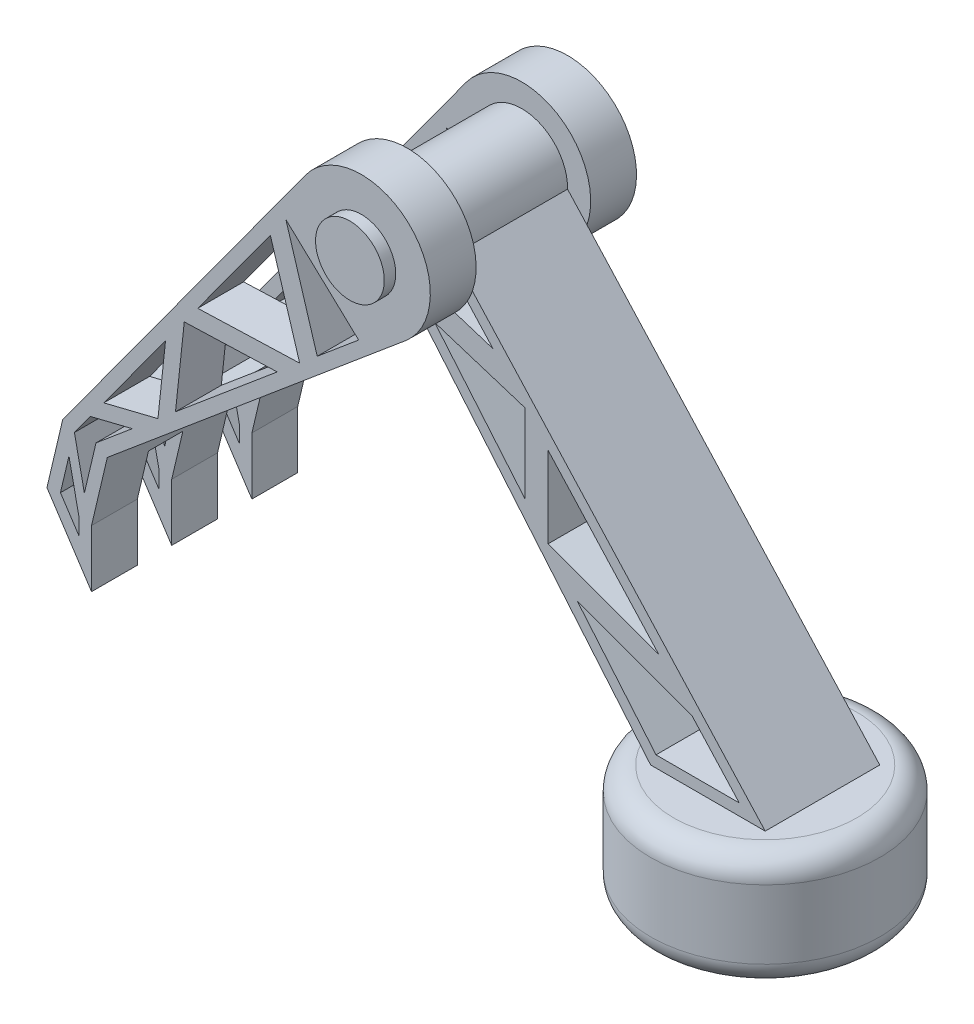
from build123d import *

# Parameters (mm, degrees)
SKETCH2_R            = 12.7
BOSS_EXTRUDE1_DEPTH  = 12.7
BOSS_EXTRUDE2_DEPTH  = 6.35
CUT_EXTRUDE1_START   = -6.35
CUT_EXTRUDE1_DEPTH   = 7.62
BOSS_EXTRUDE3_DEPTH  = 6.35
SKETCH6_R            = 3.81
BOSS_EXTRUDE4_DEPTH  = 12.7
BOSS_EXTRUDE5_START  = -1.27
SKETCH7_R            = 7.64274541
SKETCH7_R_2          = 3.81
BOSS_EXTRUDE5_DEPTH  = 5.08
CUT_EXTRUDE2_DEPTH   = 94.001963864
SKETCH14_R           = 7.62
CUT_EXTRUDE3_DEPTH   = 6.35
BOSS_EXTRUDE12_REACH = 93.815
FILLET1_R            = 2.54
CUT_EXTRUDE5_REACH   = 105.401
SKETCH16_W           = 3.81
SKETCH16_H           = 8.99772588


with BuildPart() as part:
    # Sketch2 → Boss-Extrude1 (new body)
    with BuildSketch(Plane(origin=(0, 0, 0), x_dir=(1, 0, 0), z_dir=(0, 1, 0))):
        with Locations(Location((0, 0, 0), (0, 0, 270))):
            Circle(SKETCH2_R)
    extrude(amount=BOSS_EXTRUDE1_DEPTH)

    # Sketch3 → Boss-Extrude2 (add, symmetric)
    with BuildSketch(Plane.XY):
        with BuildLine():
            Line((6.35, 12.7), (-28.263014494, 50.680235189))
            ThreePointArc((-28.263014494, 50.680235189), (-36.606963582, 54.691505771), (-34.105544768, 45.777770191))
            Line((-34.105544768, 45.777770191), (-6.35, 12.7))
            Line((-6.35, 12.7), (6.35, 12.7))
        make_face()
    extrude(amount=BOSS_EXTRUDE2_DEPTH, both=True)

    # Sketch4 → Cut-Extrude1 (cut, symmetric)
    with BuildSketch(Plane.XY.offset(6.35).offset(CUT_EXTRUDE1_START)):
        with BuildLine():
            Line((-5.757789274, 13.97), (3.474314319, 13.97))
            Line((3.474314319, 13.97), (-29.573983747, 50.233300134))
            ThreePointArc((-29.573983747, 50.233300134), (-35.779559637, 53.727877238), (-33.46657952, 46.992050322))
            Line((-33.46657952, 46.992050322), (-5.757789274, 13.97))
        make_face()
    extrude(amount=CUT_EXTRUDE1_DEPTH, both=True, mode=Mode.SUBTRACT)

    # Sketch5 → Boss-Extrude3 (add, symmetric)
    with BuildSketch(Plane.XY):
        Polygon((-23.82267484, 43.922492823), (-20.27066661, 40.024938393), (-30.298747694, 43.216775363), (-33.46657952, 46.992050322), align=None)
        Polygon((-20.27066661, 40.024938393), (-20.27066661, 31.265773704), (-17.73066661, 28.238719579), (-17.73066661, 37.237842303), align=None)
        Polygon((-5.458773455, 23.772115752), (-1.772739842, 19.727497693), (-14.465305553, 24.347213808), (-17.73066661, 28.238719579), align=None)
    extrude(amount=BOSS_EXTRUDE3_DEPTH, both=True)

    # Sketch6 → Boss-Extrude4 (add, symmetric)
    with BuildSketch(Plane.XY):
        with Locations((-33.341602525, 50.8)):
            Circle(SKETCH6_R)
    extrude(amount=BOSS_EXTRUDE4_DEPTH, both=True)

    # Sketch7 → Boss-Extrude5 (add)
    # profile 1 of 4: a face of its own
    with BuildSketch(Plane.XY.offset(12.7).offset(BOSS_EXTRUDE5_START)):
        with Locations((-33.341602525, 50.8)):
            Circle(SKETCH7_R)
        with Locations(Location((-33.341602525, 50.8, 0), (0, 0, 268.120225958))):
            Circle(SKETCH7_R_2, mode=Mode.SUBTRACT)
    # profile 2 of 4: a face of its own
    with BuildSketch(Plane.XY.offset(12.7).offset(BOSS_EXTRUDE5_START)):
        with BuildLine():
            ThreePointArc((-28.428940471, 44.945317348), (-38.558455358, 45.2146617), (-39.517448502, 55.302275411))
            Line((-39.517448502, 55.302275411), (-66.450706217, 18.357478363))
            Line((-66.450706217, 18.357478363), (-61.506739525, 17.189748362))
            Line((-61.506739525, 17.189748362), (-28.428940471, 44.945317348))
        make_face()
    # profile 3 of 4: a face of its own
    with BuildSketch(Plane.XY.offset(12.7).offset(BOSS_EXTRUDE5_START)):
        Polygon((-61.506739525, 17.189748362), (-63.258334527, 9.773798325), (-68.202301218, 10.941528326), (-66.450706217, 18.357478363), align=None)
    # profile 4 of 4: a face of its own
    with BuildSketch(Plane.XY.offset(12.7).offset(BOSS_EXTRUDE5_START)):
        Polygon((-68.202301218, 10.941528326), (-63.258334527, 3.423798325), (-63.258334527, 9.773798325), align=None)
    extrude(amount=-BOSS_EXTRUDE5_DEPTH)

    # Sketch10 → Cut-Extrude2 (cut, through all)
    with BuildSketch(Plane.XY.offset(11.43)):
        Polygon((-43.431264654, 47.562180038), (-51.48051274, 36.520892717), (-40.182838097, 36.906280169), align=None)
        Polygon((-52.976804835, 34.468403992), (-53.949591662, 25.35460233), (-42.669146252, 34.820019913), align=None)
        Polygon((-55.05214832, 31.621620856), (-61.893965932, 22.236585976), (-55.895344547, 23.721921802), align=None)
        Polygon((-64.655334527, 9.936540168), (-65.75979615, 15.205273966), (-66.70434579, 11.206214291), (-64.655334527, 8.090515014), align=None)
        Polygon((-63.390258027, 20.184097251), (-65.155875161, 17.762170896), (-64.051413538, 12.493437098), (-62.759783939, 17.96197324), (-58.739005045, 21.335807327), align=None)
        Polygon((-41.708282924, 49.925622701), (-38.237085212, 38.538960697), (-33.643800576, 42.393184141), align=None)
    extrude(amount=-CUT_EXTRUDE2_DEPTH, mode=Mode.SUBTRACT)

    # Mirror1: part across plane


with BuildPart() as part_1:
    add(part.part)
    add(part.part.mirror(Plane.XY))

    # Sketch14 → Cut-Extrude3 (cut)
    with BuildSketch(Plane.XZ):
        with Locations(Location((0, 0, 0), (0, 0, 270))):
            Circle(SKETCH14_R)
    extrude(amount=-CUT_EXTRUDE3_DEPTH, mode=Mode.SUBTRACT)

    # Sketch15 → Boss-Extrude12 (add, up to next)
    with BuildSketch(Plane.XY.offset(-6.35), mode=Mode.PRIVATE) as boss_extrude12_sk1:
        Polygon((-64.9758417, 18.009125785), (-66.450706217, 18.357478363), (-68.202301218, 10.941528326), (-63.258334527, 3.423798325), (-63.258334527, 9.773798325), (-61.506739525, 17.189748362), (-62.866330365, 17.510874112), (-64.051413538, 12.493437098), (-65.155875161, 17.762170896), align=None)
        Polygon((-64.655334527, 8.090515014), (-66.70434579, 11.206214291), (-65.75979615, 15.205273966), (-64.655334527, 9.936540168), align=None, mode=Mode.SUBTRACT)
    boss_extrude12_tool1 = extrude(boss_extrude12_sk1.sketch, amount=BOSS_EXTRUDE12_REACH, mode=Mode.PRIVATE) - part_1.part
    add(boss_extrude12_tool1.solids().sort_by_distance((-64.87727, 11.921902, -6.35))[0])

    # Fillet1
    fillet1_edges = [part_1.edges().sort_by_distance(p)[0] for p in [
        (0, 0, -12.7),
        (0, 12.7, -12.7),
    ]]
    fillet(fillet1_edges, radius=FILLET1_R)

    # Sketch16 → Cut-Extrude5 (cut, up to next)
    with BuildSketch(Plane(origin=(-42.587828759, -28.007497849, 0), x_dir=(0, 0, 1), z_dir=(-0.835514451237255, -0.54946847204704, 0)), mode=Mode.PRIVATE) as cut_extrude5_sk1:
        with Locations((-4.445, 42.117956336)):
            Rectangle(SKETCH16_W, SKETCH16_H)
    cut_extrude5_tool1 = extrude(cut_extrude5_sk1.sketch, amount=-CUT_EXTRUDE5_REACH, mode=Mode.PRIVATE) & part_1.part
    # Sketch16 → Cut-Extrude5 (cut, up to next)
    with BuildSketch(Plane(origin=(-42.587828759, -28.007497849, 0), x_dir=(0, 0, 1), z_dir=(-0.835514451237255, -0.54946847204704, 0)), mode=Mode.PRIVATE) as cut_extrude5_sk2:
        with Locations((4.445, 42.117956336)):
            Rectangle(SKETCH16_W, SKETCH16_H)
    cut_extrude5_tool2 = extrude(cut_extrude5_sk2.sketch, amount=-CUT_EXTRUDE5_REACH, mode=Mode.PRIVATE) & part_1.part
    add(cut_extrude5_tool1.solids().sort_by_distance((-65.730318, 7.182663, -4.445))[0], mode=Mode.SUBTRACT)
    add(cut_extrude5_tool2.solids().sort_by_distance((-65.730318, 7.182663, 4.445))[0], mode=Mode.SUBTRACT)


solid = part_1.part
